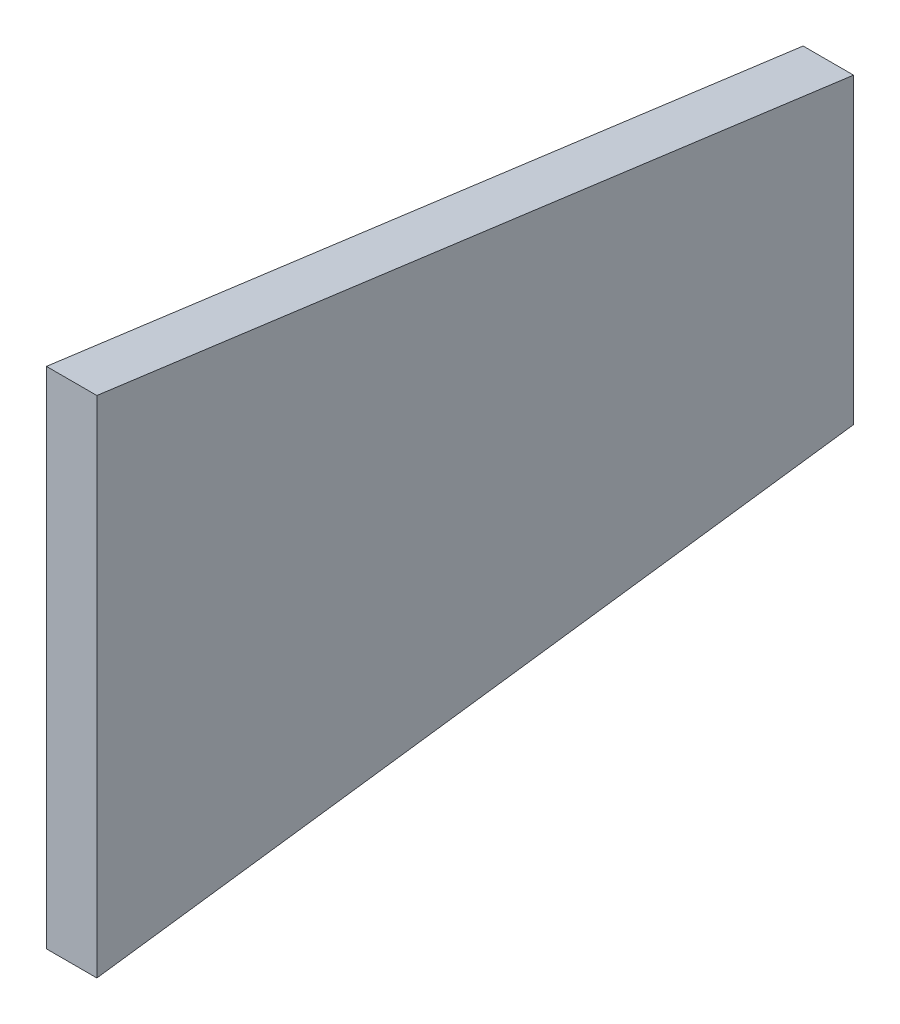
from build123d import *

# Parameters (mm, degrees)
BOSS_EXTRUDE1_DEPTH = 10


with BuildPart() as part:
    # Sketch1 → Boss-Extrude1 (new body)
    with BuildSketch(Plane(origin=(0, 0, 0), x_dir=(0, 0, -1), z_dir=(1, 0, 0))):
        Polygon((0, 0), (150, -20), (150, -80), (0, -100), align=None)
    extrude(amount=BOSS_EXTRUDE1_DEPTH)


solid = part.part
